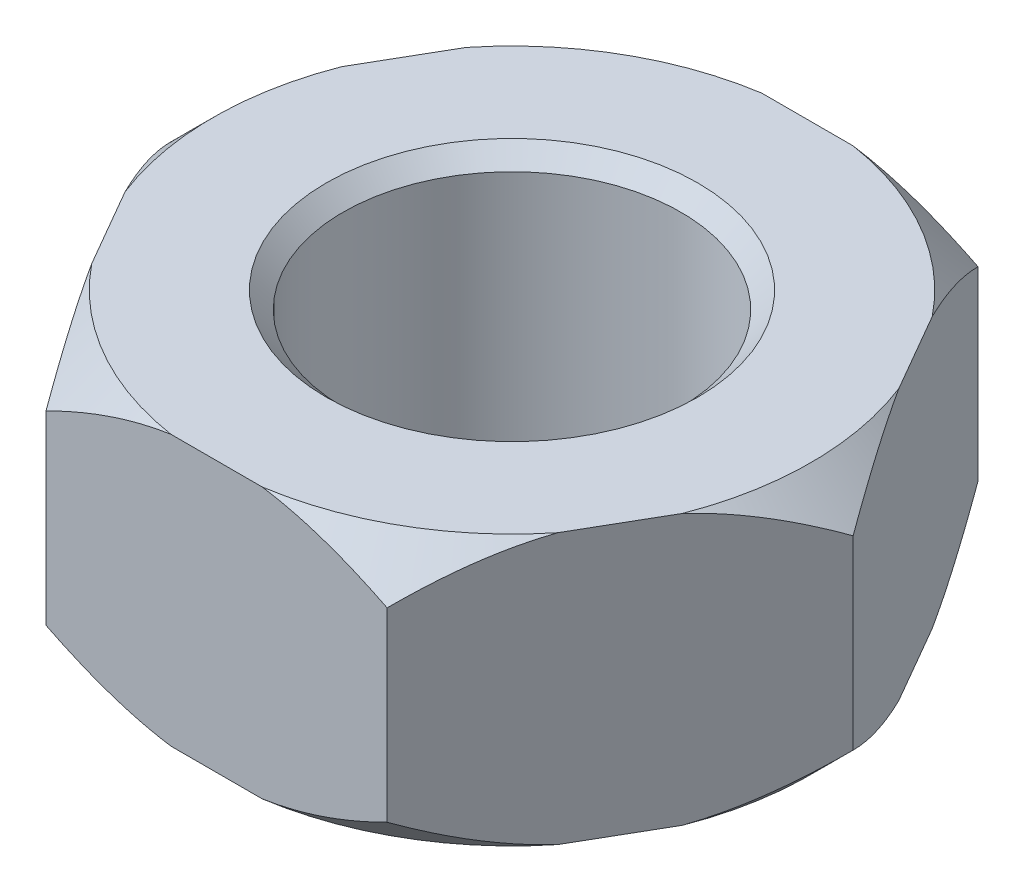
from build123d import *

# Parameters (mm, degrees)
EXTRUDE_1_DEPTH     = 3.2
SKETCH_5_R          = 2
CUT_EXTRUDE_1_DEPTH = 7.23083729
CHAMFER_1_SIZE      = 0.2


with BuildPart() as part:
    # Эскиз1 → Вытянуть1 (new body)
    with BuildSketch(Plane(origin=(0, 0, 0), x_dir=(1, 0, 0), z_dir=(0, 1, 0))):
        Polygon((-2.020725942, 3.5), (2.020725942, 3.5), (4.041451884, 0), (2.020725942, -3.5), (-2.020725942, -3.5), (-4.041451884, 0), align=None)
    extrude(amount=-EXTRUDE_1_DEPTH)

    # Эскиз5 → Вырез-Вытянуть1 (cut, through all)
    with BuildSketch(Plane.XZ.offset(3.2)):
        with Locations(Location((0, 0, 0), (0, 0, 270))):
            Circle(SKETCH_5_R)
    extrude(amount=-CUT_EXTRUDE_1_DEPTH, mode=Mode.SUBTRACT)

    # Эскиз4 → Вырез-Повернуть1 (revolve, cut)
    with BuildSketch(Plane.XY):
        Polygon((-4.041451884, -0.5), (-3.541451884, 0), (-4.041451884, 0), align=None)
        Polygon((-4.041451884, -2.7), (-3.541451884, -3.2), (-4.041451884, -3.2), align=None)
    revolve(axis=Axis((0, 0, 0), (0, -1, 0)), mode=Mode.SUBTRACT)

    # Фаска1
    chamfer_1_edges = [part.edges().sort_by_distance(p)[0] for p in [
        (0, 0, 2),
        (0, -3.2, 2),
    ]]
    chamfer(chamfer_1_edges, length=CHAMFER_1_SIZE)


solid = part.part
